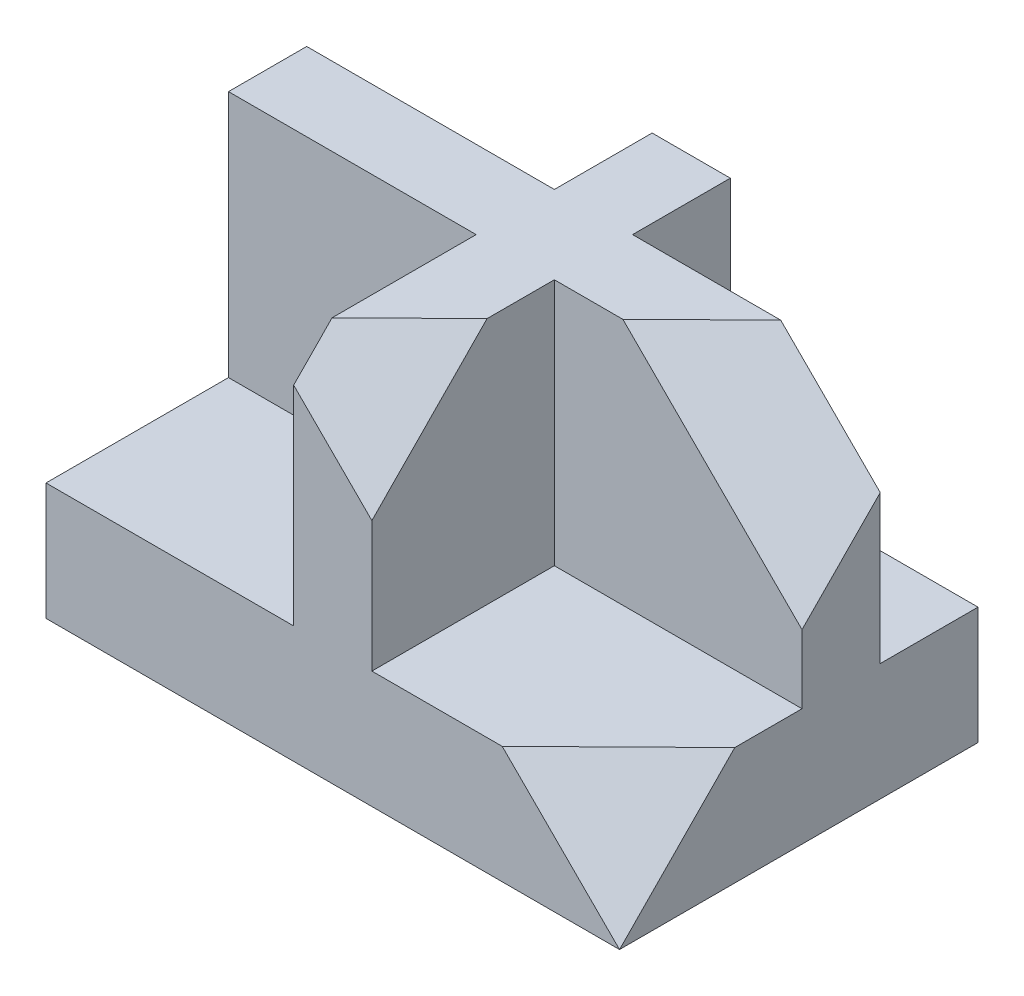
from build123d import *

# Parameters (mm, degrees)
SKETCH1_W           = 88
SKETCH1_H           = 55
BOSS_EXTRUDE1_DEPTH = 18
BOSS_EXTRUDE2_DEPTH = 38
CUT_EXTRUDE4_DEPTH  = 38


with BuildPart() as part:
    # Sketch1 → Boss-Extrude1 (new body)
    with BuildSketch(Plane(origin=(0, 0, 0), x_dir=(1, 0, 0), z_dir=(0, 1, 0))):
        Rectangle(SKETCH1_W, SKETCH1_H)
    extrude(amount=BOSS_EXTRUDE1_DEPTH)

    # Sketch2 → Boss-Extrude2 (add)
    with BuildSketch(Plane(origin=(0, 18, 0), x_dir=(1, 0, 0), z_dir=(0, 1, 0))):
        Polygon((-6, 27.5), (-6, 12.5), (-44, 12.5), (-44, 0.5), (-6, 0.5), (-6, -27.5), (6, -27.5), (6, 0.5), (44, 0.5), (44, 12.5), (6, 12.5), (6, 27.5), align=None)
    extrude(amount=BOSS_EXTRUDE2_DEPTH)

    # Sketch6 → Cut-Extrude4 (cut)
    with BuildSketch(Plane(origin=(23.709993468, 23.709993468, 24.141084259), x_dir=(-0.8189594221707254, 0.4021022970404831, 0.4094132478957647), z_dir=(-0.5738514309799984, -0.5738514309800047, -0.5842850933614594))):
        Polygon((-24.775350258, -19.269470409), (43.604106017, 20.683626585), (-24.775350258, 59.222567403), align=None)
    extrude(amount=-CUT_EXTRUDE4_DEPTH, mode=Mode.SUBTRACT)


solid = part.part
